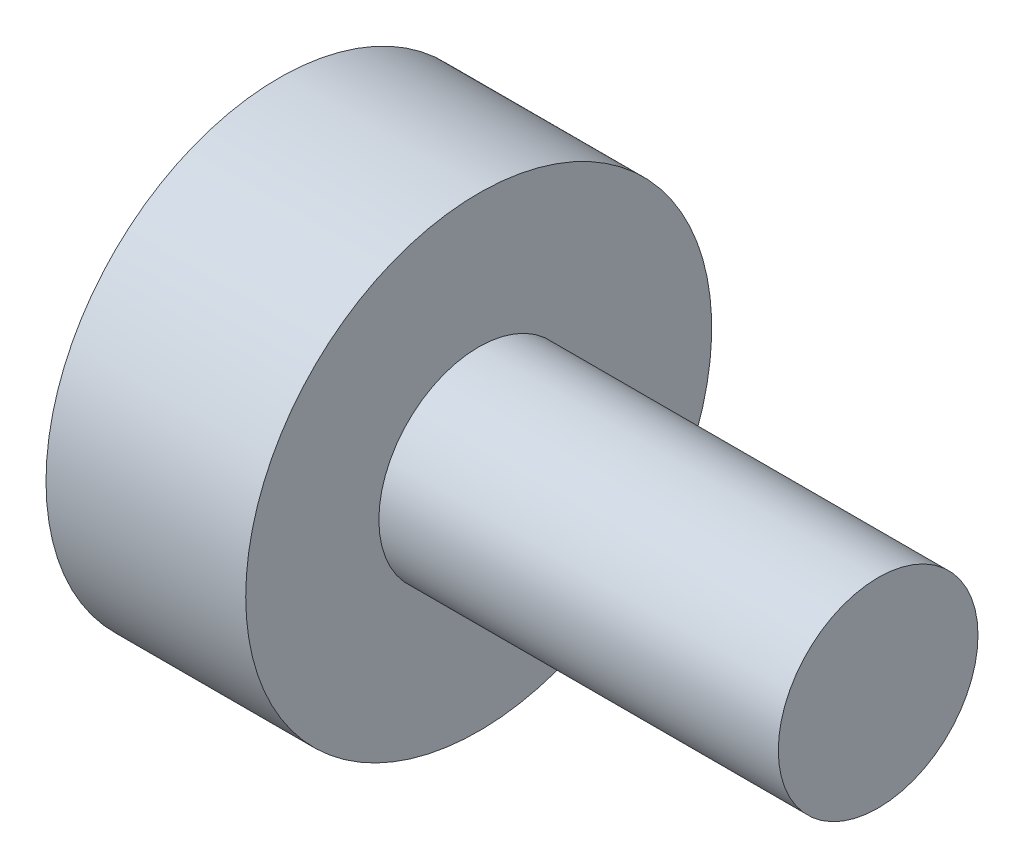
from build123d import *

# Parameters (mm, degrees)
SKETCH_2_R          = 5
CUT_EXTRUDE_1_DEPTH = 20
SKETCH_3_R          = 5
CUT_EXTRUDE_2_DEPTH = 20


with BuildPart() as part:
    # Эскиз1 → Повернуть1 (revolve)
    with BuildSketch(Plane.XY, mode=Mode.PRIVATE) as revolve_1_sk:
        Polygon((0, 0), (100, 0), (100, 15), (40, 15), (40, 35), (10, 35), (10, 20), (0, 20), align=None)
    revolve(revolve_1_sk.sketch.rotate(Axis((0, 0, 0), (1, 0, 0)), 90), axis=Axis((0, 0, 0), (1, 0, 0)))

    # Эскиз2 → Вырез-Вытянуть1 (cut)
    with BuildSketch(Plane(origin=(0, 0, 0), x_dir=(0, 0, -1), z_dir=(1, 0, 0))):
        with Locations((10, 10)):
            Circle(SKETCH_2_R)
    extrude(amount=CUT_EXTRUDE_1_DEPTH, mode=Mode.SUBTRACT)

    # Эскиз3 → Вырез-Вытянуть2 (cut)
    with BuildSketch(Plane(origin=(0, 0, 0), x_dir=(0, 0, -1), z_dir=(1, 0, 0))):
        with Locations((-10, 10)):
            Circle(SKETCH_3_R)
    extrude(amount=CUT_EXTRUDE_2_DEPTH, mode=Mode.SUBTRACT)


solid = part.part
